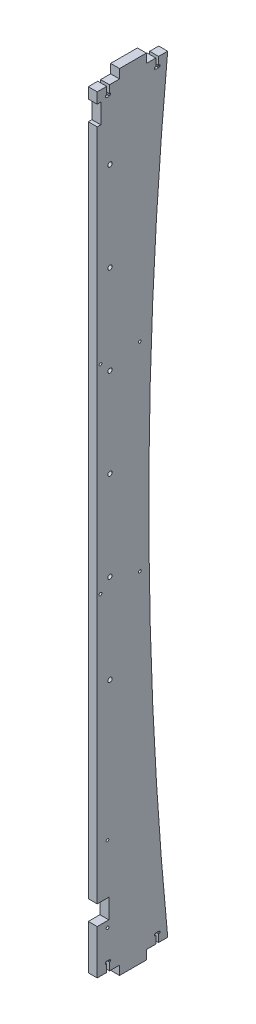
from build123d import *

# Parameters (mm, degrees)
DODANIE_WYCI_GNI_CIE1_DEPTH = 10
SZKIC1_W                    = 30
SZKIC1_H                    = 10.1
SZKIC1_W_2                  = 25
WYTNIJ_WYCI_GNI_CIE1_DEPTH  = 10
WYTNIJ_WYCI_GNI_CIE2_DEPTH  = 10
SZYK_LINIOWY1_COUNT         = 2
SZYK_LINIOWY1_PITCH         = 55
SZKIC5_R                    = 1.55
WYTNIJ_WYCI_GNI_CIE3_DEPTH  = 10
SZKIC7_R                    = 2.45
WYTNIJ_WYCI_GNI_CIE5_DEPTH  = 10
SZYK_LINIOWY3_COUNT         = 6
SZYK_LINIOWY3_PITCH         = 100
SZKIC8_W                    = 13
SZKIC8_H                    = 22
WYTNIJ_WYCI_GNI_CIE6_DEPTH  = 10
SZKIC9_W                    = 4
SZKIC9_H                    = 22
WYTNIJ_WYCI_GNI_CIE7_DEPTH  = 10
LUSTRO1_COPY_1_DEPTH        = 10
SZKIC12_R                   = 1.55
WYTNIJ_WYCI_GNI_CIE8_DEPTH  = 10
SZYK_LINIOWY4_COUNT         = 2
SZYK_LINIOWY4_PITCH         = 223


with BuildPart() as part:
    # Szkic11 → Dodanie-wyciągnięcie1 (new body)
    with BuildSketch(Plane.ZY.offset(-248.52281754)):
        with BuildLine():
            Line((-79.001367167, 0), (0, 0))
            Line((0, 0), (0, 880))
            Line((0, 880), (-78.955177412, 880))
            Line((-78.955177412, 880), (-78.955177412, 870))
            ThreePointArc((-78.955177412, 870), (-57.819766969, 439.998863597), (-79.001367167, 10))
            Line((-79.001367167, 10), (-79.001367167, 0))
        make_face()
    extrude(amount=DODANIE_WYCI_GNI_CIE1_DEPTH)

    # Szkic1 → Wytnij-wyciągnięcie1 (cut)
    with BuildSketch(Plane(origin=(248.52281754, 0, 0), x_dir=(0, 0, -1), z_dir=(1, 0, 0))):
        with Locations((70, 874.95)):
            Rectangle(SZKIC1_W, SZKIC1_H)
        with Locations((12.5, 874.95)):
            Rectangle(SZKIC1_W_2, SZKIC1_H)
    wytnij_wyci_gni_cie1 = extrude(amount=-WYTNIJ_WYCI_GNI_CIE1_DEPTH, mode=Mode.SUBTRACT)

    # Szkic2 → Wytnij-wyciągnięcie2 (cut)
    with BuildSketch(Plane(origin=(248.52281754, 0, 0), x_dir=(0, 0, -1), z_dir=(1, 0, 0))):
        Polygon((10.660920663, 869.9), (13.760920663, 869.9), (13.760920663, 861.4), (15.135920663, 861.4), (15.135920663, 859.4), (13.760920663, 859.4), (13.760920663, 858.9), (10.660920663, 858.9), (10.660920663, 859.4), (9.285920663, 859.4), (9.285920663, 861.4), (10.660920663, 861.4), align=None)
    wytnij_wyci_gni_cie2 = extrude(amount=-WYTNIJ_WYCI_GNI_CIE2_DEPTH, mode=Mode.SUBTRACT)

    # Szyk liniowy1: Wytnij-wyciągnięcie2 ×2
    with Locations(*[(0, 0, -i * SZYK_LINIOWY1_PITCH) for i in range(1, SZYK_LINIOWY1_COUNT)]):
        add(wytnij_wyci_gni_cie2, mode=Mode.SUBTRACT)

    # Szkic5 → Wytnij-wyciągnięcie3 (cut)
    with BuildSketch(Plane.ZY.offset(-248.52281754)):
        with Locations((-11.55, 53)):
            Circle(SZKIC5_R)
        with Locations((-11.55, 138)):
            Circle(SZKIC5_R)
    extrude(amount=WYTNIJ_WYCI_GNI_CIE3_DEPTH, mode=Mode.SUBTRACT)

    # Szkic7 → Wytnij-wyciągnięcie5 (cut)
    with BuildSketch(Plane(origin=(248.52281754, 0, 0), x_dir=(0, 0, -1), z_dir=(1, 0, 0))):
        with Locations((14.31069395, 792.236985413)):
            Circle(SZKIC7_R)
    wytnij_wyci_gni_cie5 = extrude(amount=-WYTNIJ_WYCI_GNI_CIE5_DEPTH, mode=Mode.SUBTRACT)

    # Szyk liniowy3: Wytnij-wyciągnięcie5 ×6
    with Locations(*[(0, -i * SZYK_LINIOWY3_PITCH, 0) for i in range(1, SZYK_LINIOWY3_COUNT)]):
        add(wytnij_wyci_gni_cie5, mode=Mode.SUBTRACT)

    # Szkic8 → Wytnij-wyciągnięcie6 (cut)
    with BuildSketch(Plane(origin=(248.52281754, 0, 0), x_dir=(0, 0, -1), z_dir=(1, 0, 0))):
        with Locations((6.5, 71)):
            Rectangle(SZKIC8_W, SZKIC8_H)
    extrude(amount=-WYTNIJ_WYCI_GNI_CIE6_DEPTH, mode=Mode.SUBTRACT)

    # Szkic9 → Wytnij-wyciągnięcie7 (cut)
    with BuildSketch(Plane(origin=(248.52281754, 0, 0), x_dir=(0, 0, -1), z_dir=(1, 0, 0))):
        with Locations((2, 846.9)):
            Rectangle(SZKIC9_W, SZKIC9_H)
    extrude(amount=-WYTNIJ_WYCI_GNI_CIE7_DEPTH, mode=Mode.SUBTRACT)

    # Lustro1: Wytnij-wyciągnięcie1, Wytnij-wyciągnięcie2 across plane
    add(wytnij_wyci_gni_cie1.mirror(Plane.ZX.offset(440)), mode=Mode.SUBTRACT)
    add(wytnij_wyci_gni_cie2.mirror(Plane.ZX.offset(440)), mode=Mode.SUBTRACT)

    # Lustro1 copy 1 sketch → Lustro1 copy 1 (cut)
    with BuildSketch(Plane(origin=(248.52281754, 880, -55), x_dir=(0, 0, -1), z_dir=(1, 0, 0))):
        Polygon((10.660920663, -869.9), (13.760920663, -869.9), (13.760920663, -861.4), (15.135920663, -861.4), (15.135920663, -859.4), (13.760920663, -859.4), (13.760920663, -858.9), (10.660920663, -858.9), (10.660920663, -859.4), (9.285920663, -859.4), (9.285920663, -861.4), (10.660920663, -861.4), align=None)
    extrude(amount=-LUSTRO1_COPY_1_DEPTH, mode=Mode.SUBTRACT)

    # Szkic12 → Wytnij-wyciągnięcie8 (cut)
    with BuildSketch(Plane.ZY.offset(-238.52281754)):
        with Locations((-47.7, 603.736985413)):
            Circle(SZKIC12_R)
        with Locations((-3.7, 603.736985413)):
            Circle(SZKIC12_R)
    wytnij_wyci_gni_cie8 = extrude(amount=-WYTNIJ_WYCI_GNI_CIE8_DEPTH, mode=Mode.SUBTRACT)

    # Szyk liniowy4: Wytnij-wyciągnięcie8 ×2
    with Locations(*[(0, -i * SZYK_LINIOWY4_PITCH, 0) for i in range(1, SZYK_LINIOWY4_COUNT)]):
        add(wytnij_wyci_gni_cie8, mode=Mode.SUBTRACT)


solid = part.part
